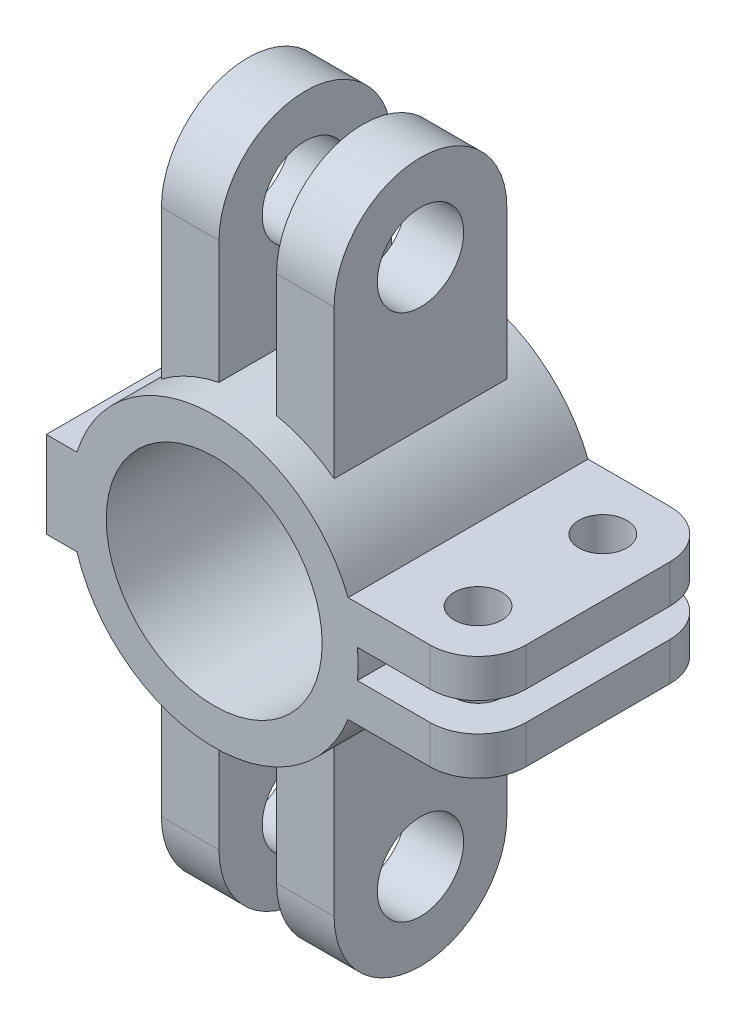
from build123d import *

# Parameters (mm, degrees)
BOSS_EXTRUDE1_START     = 6
BOSS_EXTRUDE1_DEPTH     = 12
BOSS_EXTRUDE2_START     = -6
BOSS_EXTRUDE2_DEPTH     = 12
SKETCH3_R               = 22.5
BOSS_EXTRUDE3_DEPTH     = 25
HOLE1_D                 = 18
HOLE2_D                 = 18
HOLE3_D                 = 10
FILLET1_R               = 10
CUT_EXTRUDE1_DEPTH      = 95.757585448
CUT_EXTRUDE1_DEPTH_BACK = 95.757585448
SKETCH11_R              = 22.5


with BuildPart() as part:
    # Sketch1 → Boss-Extrude1 (new body)
    with BuildSketch(Plane(origin=(0, 0, 0), x_dir=(0, 0, -1), z_dir=(1, 0, 0)).offset(BOSS_EXTRUDE1_START)):
        with BuildLine():
            Line((18, 55), (18, -55))
            ThreePointArc((18, -55), (0, -73), (-18, -55))
            Line((-18, -55), (-18, 55))
            ThreePointArc((-18, 55), (0, 73), (18, 55))
        make_face()
    extrude(amount=BOSS_EXTRUDE1_DEPTH)



with BuildPart() as body_2:
    # Sketch2 → Boss-Extrude2 (new body)
    with BuildSketch(Plane(origin=(0, 0, 0), x_dir=(0, 0, -1), z_dir=(1, 0, 0)).offset(BOSS_EXTRUDE2_START)):
        with BuildLine():
            Line((18, -55), (18, 55))
            ThreePointArc((18, 55), (0, 73), (-18, 55))
            Line((-18, 55), (-18, -55))
            ThreePointArc((-18, -55), (0, -73), (18, -55))
        make_face()
    extrude(amount=-BOSS_EXTRUDE2_DEPTH)


with BuildPart() as part_1:
    add(part.part)

    add(body_2.part)  # Boss-Extrude3 merges body 2
    # Sketch3 → Boss-Extrude3 (add, symmetric)
    with BuildSketch(Plane.XY):
        with BuildLine():
            Line((-35, 9), (-28.618176043, 9))
            ThreePointArc((-28.618176043, 9), (-1.060743162, 29.981241201), (27.910571474, 11))
            Line((27.910571474, 11), (55, 11))
            Line((55, 11), (55, 3))
            Line((55, 3), (29.849623113, 3))
            ThreePointArc((29.849623113, 3), (30, 0), (29.849623113, -3))
            Line((29.849623113, -3), (55, -3))
            Line((55, -3), (55, -11))
            Line((55, -11), (27.910571474, -11))
            ThreePointArc((27.910571474, -11), (-1.060743162, -29.981241201), (-28.618176043, -9))
            Line((-28.618176043, -9), (-35, -9))
            Line((-35, -9), (-35, 9))
        make_face()
        Circle(SKETCH3_R, mode=Mode.SUBTRACT)
    extrude(amount=BOSS_EXTRUDE3_DEPTH, both=True)

    # Hole1 (through all)
    with Locations(Plane(origin=(18, 0, 0), x_dir=(0, 0, -1), z_dir=(1, 0, 0))):
        with Locations((0, 55)):
            Hole(HOLE1_D / 2)

    # Hole2 (through all)
    with Locations(Plane(origin=(18, 0, 0), x_dir=(0, 0, -1), z_dir=(1, 0, 0))):
        with Locations((0, -55)):
            Hole(HOLE2_D / 2)

    # Hole3 (through all)
    with Locations(Plane(origin=(0, 11, 0), x_dir=(1, 0, 0), z_dir=(0, 1, 0))):
        with Locations((43, -13)):
            hole3 = Hole(HOLE3_D / 2)

    # Mirror2: Hole3 across plane
    add(hole3.mirror(Plane.XY), mode=Mode.SUBTRACT)

    # Fillet1
    fillet1_edges = [part_1.edges().sort_by_distance(p)[0] for p in [
        (55, -7, 25),
        (55, 7, 25),
        (55, -7, -25),
        (55, 7, -25),
    ]]
    fillet(fillet1_edges, radius=FILLET1_R)

    # Sketch11 → Cut-Extrude1 (cut, two sides: drawn at the far end of the back side and taken through both)
    with BuildSketch(Plane.XY.offset(-CUT_EXTRUDE1_DEPTH_BACK)):
        Circle(SKETCH11_R)
    extrude(amount=CUT_EXTRUDE1_DEPTH + CUT_EXTRUDE1_DEPTH_BACK, mode=Mode.SUBTRACT)


solid = part_1.part
